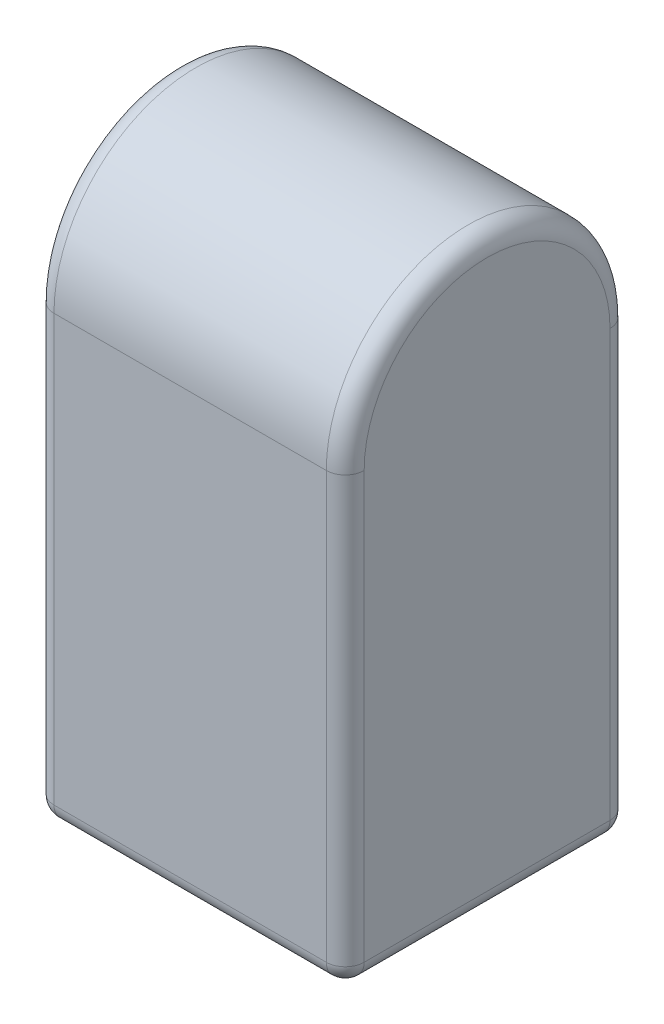
from build123d import *

# Parameters (mm, degrees)
BOSS_EXTRUDE1_DEPTH = 16.383
FILLET1_R           = 2


with BuildPart() as part:
    # Sketch1 → Boss-Extrude1 (new, symmetric)
    with BuildSketch(Plane(origin=(0, 0, 0), x_dir=(0, 0, -1), z_dir=(1, 0, 0))):
        with BuildLine():
            Line((-14.986, 46.99), (-14.986, 0))
            Line((-14.986, 0), (14.986, 0))
            Line((14.986, 0), (14.986, 46.99))
            ThreePointArc((14.986, 46.99), (0, 61.976), (-14.986, 46.99))
        make_face()
    extrude(amount=BOSS_EXTRUDE1_DEPTH, both=True)

    # Fillet1
    fillet1_edges = [part.edges().sort_by_distance(p)[0] for p in [
        (16.383, 0, 0),
        (16.383, 23.495, -14.986),
        (16.383, 61.976, 0),
        (-16.383, 23.495, -14.986),
        (-16.383, 0, 0),
        (-16.383, 23.495, 14.986),
        (-16.383, 61.976, 0),
        (0, 0, -14.986),
        (0, 0, 14.986),
        (16.383, 23.495, 14.986),
    ]]
    fillet(fillet1_edges, radius=FILLET1_R)


solid = part.part
